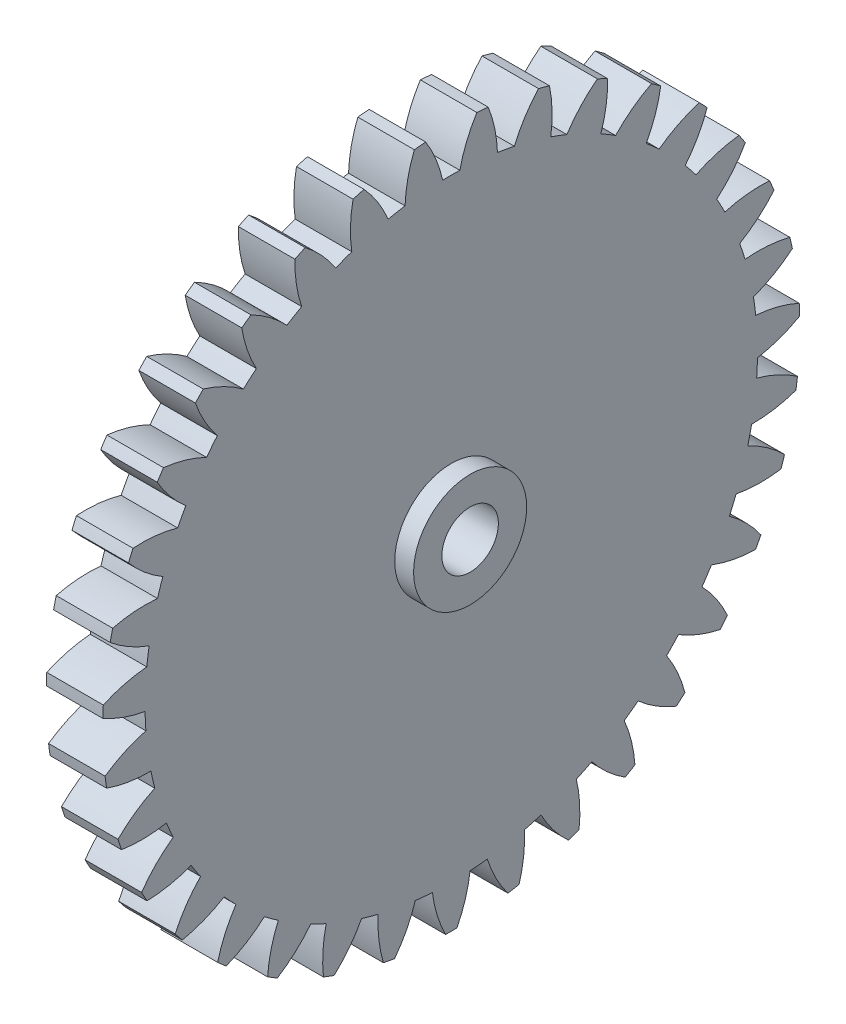
from build123d import *

# Parameters (mm, degrees)
BASPROSKE_W       = 3
BASPROSKE_H       = 18.5
TOOTHCUT_DEPTH    = 27.334388165
TEETHCUTS_COUNT   = 35
TEETHCUTS_ANGLE   = 349.714285714
HUBNEABOTSKE_R    = 3
HUBNEARBOTH_DEPTH = 1.0000254
HUBFAR_START      = 1.0000254
HUBFARSKE_R       = 3
HUBFAR_DEPTH      = 1.0000254
BORSKE_R          = 1.5
BORE_DEPTH        = 5.0000508


with BuildPart() as part:
    # BasProSke → Base-Revolve (revolve)
    with BuildSketch(Plane(origin=(0, 0, 0), x_dir=(1, 0, 0), z_dir=(0, 1, 0)), mode=Mode.PRIVATE) as base_revolve_sk:
        with Locations((1.5, 9.25)):
            Rectangle(BASPROSKE_W, BASPROSKE_H)
    revolve(base_revolve_sk.sketch.rotate(Axis((-10, 0, 0), (1, 0, 0)), 180), axis=Axis((-10, 0, 0), (1, 0, 0)))

    # TooCutSke → ToothCut (cut, through all)
    with BuildSketch(Plane(origin=(0, 0, 0), x_dir=(0, 0, -1), z_dir=(1, 0, 0))):
        with BuildLine():
            ThreePointArc((0.456361119, 16.242590173), (0, 16.249), (-0.456361119, 16.242590173))
            ThreePointArc((-0.456361119, 16.242590173), (-0.817781123, 17.39831105), (-1.372969849, 18.474452602))
            ThreePointArc((-1.372969849, 18.474452602), (0, 18.5254), (1.372969849, 18.474452602))
            ThreePointArc((1.372969849, 18.474452602), (0.817781123, 17.39831105), (0.456361119, 16.242590173))
        make_face()
    toothcut = extrude(amount=TOOTHCUT_DEPTH, mode=Mode.SUBTRACT)

    # TeethCuts: ToothCut ×35 about axis
    teethcuts_axis = Axis((-10, 0, 0), (1, 0, 0))
    for i in range(1, TEETHCUTS_COUNT):
        add(toothcut.rotate(teethcuts_axis, i * TEETHCUTS_ANGLE / (TEETHCUTS_COUNT - 1)), mode=Mode.SUBTRACT)

    # HubNeaBotSke → HubNearBoth (add)
    with BuildSketch(Plane.ZY):
        with Locations(Location((0, 0, 0), (0, 0, 180))):
            Circle(HUBNEABOTSKE_R)
    extrude(amount=HUBNEARBOTH_DEPTH)

    # HubFarSke → HubFar (add)
    with BuildSketch(Plane(origin=(3, 0, 0), x_dir=(0, 0, -1), z_dir=(1, 0, 0)).offset(HUBFAR_START)):
        Circle(HUBFARSKE_R)
    extrude(amount=-HUBFAR_DEPTH)

    # BorSke → Bore (cut, symmetric)
    with BuildSketch(Plane(origin=(0, 0, 0), x_dir=(0, 0, -1), z_dir=(1, 0, 0))):
        with Locations(Location((0, 0, 0), (0, 0, 180))):
            Circle(BORSKE_R)
    extrude(amount=BORE_DEPTH, both=True, mode=Mode.SUBTRACT)


solid = part.part
